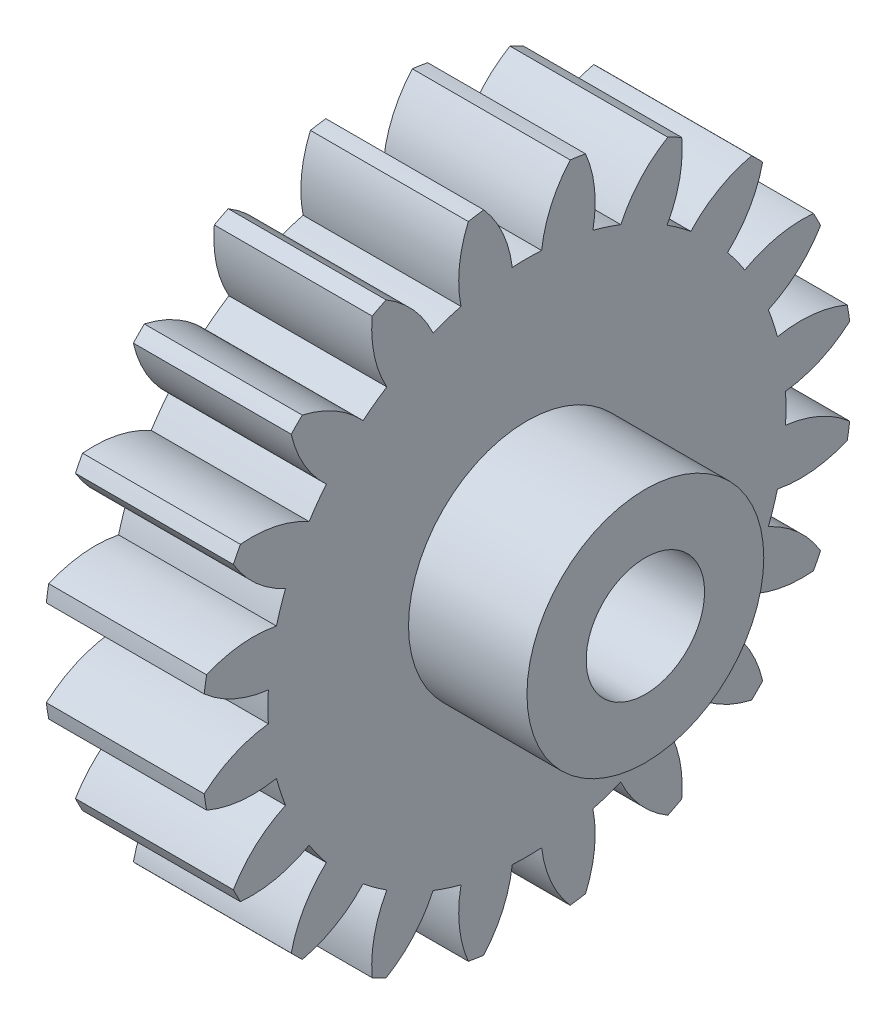
from build123d import *

# Parameters (mm, degrees)
BASPROSKE_W         = 8
BASPROSKE_H         = 16.5
TOOTHCUT_DEPTH      = 25.667792767
TEETHCUTS_COUNT     = 20
TEETHCUTS_ANGLE     = 342
BORSKE_R            = 3
BORE_DEPTH          = 50.0000508
SKETCH1_R           = 6
BOSS_EXTRUDE1_DEPTH = 6
SKETCH2_R           = 3
CUT_EXTRUDE1_DEPTH  = 6


with BuildPart() as part:
    # BasProSke → Base-Revolve (revolve)
    with BuildSketch(Plane(origin=(0, 0, 0), x_dir=(1, 0, 0), z_dir=(0, 1, 0)), mode=Mode.PRIVATE) as base_revolve_sk:
        with Locations((4, 8.25)):
            Rectangle(BASPROSKE_W, BASPROSKE_H)
    revolve(base_revolve_sk.sketch.rotate(Axis((-10, 0, 0), (1, 0, 0)), 180), axis=Axis((-10, 0, 0), (1, 0, 0)))

    # TooCutSke → ToothCut (cut, through all)
    with BuildSketch(Plane(origin=(0, 0, 0), x_dir=(0, 0, -1), z_dir=(1, 0, 0))):
        with BuildLine():
            ThreePointArc((0.74381438, 13.102904875), (0, 13.124), (-0.74381438, 13.102904875))
            ThreePointArc((-0.74381438, 13.102904875), (-1.226473103, 14.852072512), (-2.209965745, 16.376962373))
            ThreePointArc((-2.209965745, 16.376962373), (0, 16.5254), (2.209965745, 16.376962373))
            ThreePointArc((2.209965745, 16.376962373), (1.226473103, 14.852072512), (0.74381438, 13.102904875))
        make_face()
    toothcut = extrude(amount=TOOTHCUT_DEPTH, mode=Mode.SUBTRACT)

    # TeethCuts: ToothCut ×20 about axis
    teethcuts_axis = Axis((-10, 0, 0), (1, 0, 0))
    for i in range(1, TEETHCUTS_COUNT):
        add(toothcut.rotate(teethcuts_axis, i * TEETHCUTS_ANGLE / (TEETHCUTS_COUNT - 1)), mode=Mode.SUBTRACT)

    # BorSke → Bore (cut, symmetric)
    with BuildSketch(Plane(origin=(0, 0, 0), x_dir=(0, 0, -1), z_dir=(1, 0, 0))):
        with Locations(Location((0, 0, 0), (0, 0, 180))):
            Circle(BORSKE_R)
    extrude(amount=BORE_DEPTH, both=True, mode=Mode.SUBTRACT)

    # Sketch1 → Boss-Extrude1 (add)
    with BuildSketch(Plane(origin=(8, 0, 0), x_dir=(0, 0, -1), z_dir=(1, 0, 0))):
        with Locations(Location((0, 0, 0), (0, 0, 180))):
            Circle(SKETCH1_R)
    extrude(amount=BOSS_EXTRUDE1_DEPTH)

    # Sketch2 → Cut-Extrude1 (cut)
    with BuildSketch(Plane(origin=(14, 0, 0), x_dir=(0, 0, -1), z_dir=(1, 0, 0))):
        Circle(SKETCH2_R)
    extrude(amount=-CUT_EXTRUDE1_DEPTH, mode=Mode.SUBTRACT)


solid = part.part
